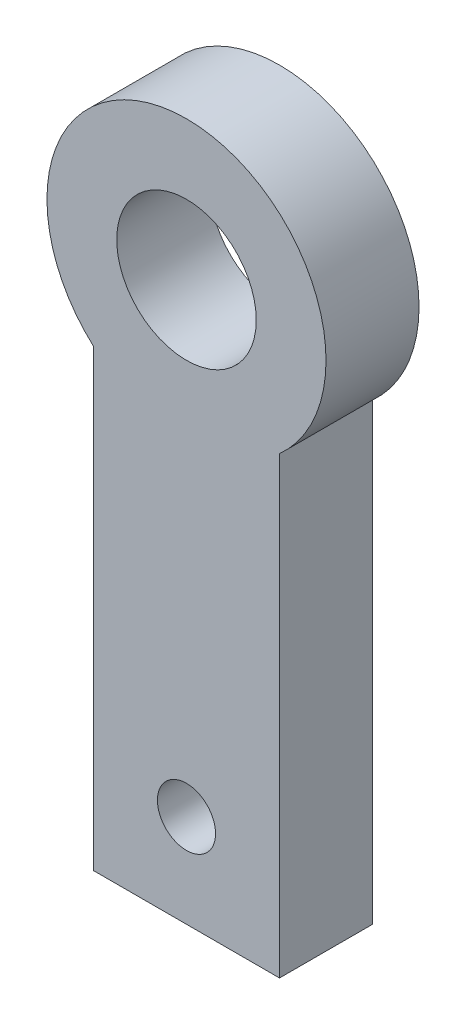
from build123d import *

# Parameters (mm, degrees)
HORN_ARM_SKETCH_W       = 8
HORN_ARM_SKETCH_H       = 24
HORN_ARM_DEPTH          = 4
HORN_HUB_SKETCH_R       = 6
HORN_HUB_DEPTH          = 4
SHAFT_BORE_SKETCH_R     = 3
SHAFT_BORE_DEPTH        = 4
BALL_STUD_HOLE_SKETCH_R = 1.25
BALL_STUD_HOLE_DEPTH    = 4


with BuildPart() as part:
    # Horn Arm Sketch → Horn Arm (new body)
    with BuildSketch(Plane.XY.offset(13.2)):
        with Locations((-91, 71.4)):
            Rectangle(HORN_ARM_SKETCH_W, HORN_ARM_SKETCH_H)
    extrude(amount=HORN_ARM_DEPTH)

    # Horn Hub Sketch → Horn Hub (add)
    with BuildSketch(Plane.XY.offset(13.2)):
        with Locations((-91, 83.4)):
            Circle(HORN_HUB_SKETCH_R)
    extrude(amount=HORN_HUB_DEPTH)

    # Shaft Bore Sketch → Shaft Bore (cut)
    with BuildSketch(Plane.XY.offset(13.2)):
        with Locations((-91, 83.4)):
            Circle(SHAFT_BORE_SKETCH_R)
    extrude(amount=SHAFT_BORE_DEPTH, mode=Mode.SUBTRACT)

    # Ball Stud Hole Sketch → Ball Stud Hole (cut)
    with BuildSketch(Plane.XY.offset(13.2)):
        with Locations((-91, 63.4)):
            Circle(BALL_STUD_HOLE_SKETCH_R)
    extrude(amount=BALL_STUD_HOLE_DEPTH, mode=Mode.SUBTRACT)


solid = part.part
